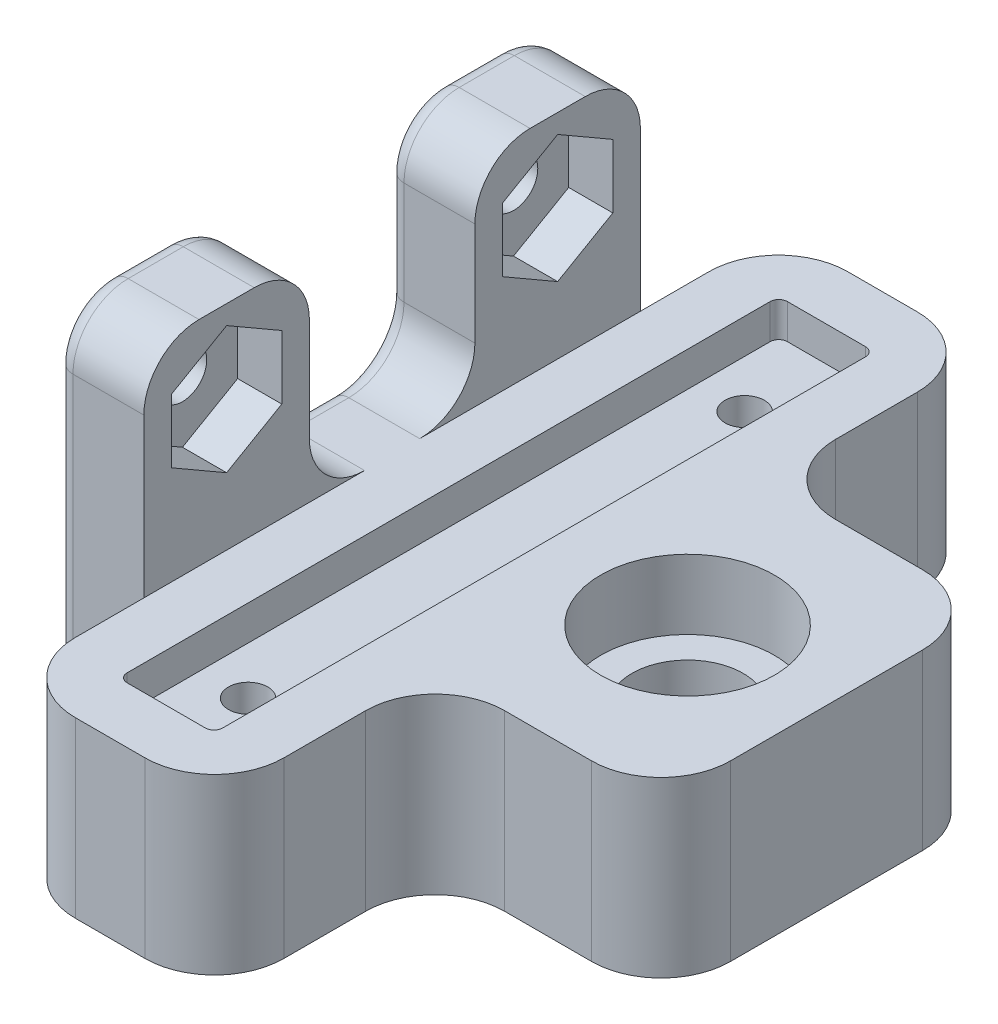
from build123d import *

# Parameters (mm, degrees)
SKETCH1_R           = 3.2
SKETCH1_R_2         = 1.1303
BOSS_EXTRUDE1_DEPTH = 10
SKETCH2_W           = 5.5
SKETCH2_H           = 38
CUT_EXTRUDE1_DEPTH  = 2
FILLET3_R           = 0.5
SKETCH5_R           = 5
CUT_EXTRUDE2_DEPTH  = 4
FILLET1_R           = 4
SKETCH4_R           = 1.397
BOSS_EXTRUDE2_DEPTH = 5.08
CUT_EXTRUDE3_DEPTH  = 2.54
FILLET5_R           = 3.175
FILLET4_R           = 1


with BuildPart() as part:
    # Sketch1 → Boss-Extrude1 (new body)
    with BuildSketch(Plane(origin=(0, 0, 0), x_dir=(1, 0, 0), z_dir=(0, 1, 0))):
        Polygon((-17, 22.225), (-5, 22.225), (-5, 9.525), (8, 9.525), (8, -9.525), (-5, -9.525), (-5, -22.225), (-17, -22.225), align=None)
        with Locations(Location((0, 0, 0), (0, 0, 270))):
            Circle(SKETCH1_R, mode=Mode.SUBTRACT)
        with Locations(Location((-11, 14.2875, 0), (0, 0, 270))):
            Circle(SKETCH1_R_2, mode=Mode.SUBTRACT)
        with Locations(Location((-11, -14.2875, 0), (0, 0, 90))):
            Circle(SKETCH1_R_2, mode=Mode.SUBTRACT)
    extrude(amount=BOSS_EXTRUDE1_DEPTH)

    # Sketch2 → Cut-Extrude1 (cut)
    with BuildSketch(Plane(origin=(0, 10, 0), x_dir=(1, 0, 0), z_dir=(0, 1, 0))):
        with Locations((-11, 0)):
            Rectangle(SKETCH2_W, SKETCH2_H)
    extrude(amount=-CUT_EXTRUDE1_DEPTH, mode=Mode.SUBTRACT)

    # Fillet3
    fillet3_edges = [part.edges().sort_by_distance(p)[0] for p in [
        (-13.75, 9, 19),
        (-13.75, 9, -19),
        (-8.25, 9, -19),
        (-8.25, 9, 19),
    ]]
    fillet(fillet3_edges, radius=FILLET3_R)

    # Sketch5 → Cut-Extrude2 (cut)
    with BuildSketch(Plane(origin=(0, 10, 0), x_dir=(1, 0, 0), z_dir=(0, 1, 0))):
        with Locations(Location((0, 0, 0), (0, 0, 270))):
            Circle(SKETCH5_R)
    extrude(amount=-CUT_EXTRUDE2_DEPTH, mode=Mode.SUBTRACT)

    # Fillet1
    fillet1_edges = [part.edges().sort_by_distance(p)[0] for p in [
        (-17, 5, 22.225),
        (-17, 5, -22.225),
        (-5, 5, -22.225),
        (-5, 5, -9.525),
        (8, 5, -9.525),
        (8, 5, 9.525),
        (-5, 5, 9.525),
        (-5, 5, 22.225),
    ]]
    fillet(fillet1_edges, radius=FILLET1_R)

    # Sketch4 → Boss-Extrude2 (add)
    with BuildSketch(Plane.ZY.offset(17)):
        Polygon((-4.7625, 10), (4.7625, 10), (4.7625, 22.2875), (14.2875, 22.2875), (14.2875, 0), (-14.2875, 0), (-14.2875, 22.2875), (-4.7625, 22.2875), align=None)
        with Locations((-9.525, 17.525)):
            Circle(SKETCH4_R, mode=Mode.SUBTRACT)
        with Locations((9.525, 17.525)):
            Circle(SKETCH4_R, mode=Mode.SUBTRACT)
    extrude(amount=BOSS_EXTRUDE2_DEPTH)

    # Sketch6 → Cut-Extrude3 (cut)
    with BuildSketch(Plane(origin=(-17, 0, 0), x_dir=(0, 0, -1), z_dir=(1, 0, 0))):
        Polygon((-6.35, 15.691912895), (-6.35, 19.358087105), (-9.525, 21.191174209), (-12.7, 19.358087105), (-12.7, 15.691912895), (-9.525, 13.858825791), align=None)
    cut_extrude3 = extrude(amount=-CUT_EXTRUDE3_DEPTH, mode=Mode.SUBTRACT)

    # Mirror1: Cut-Extrude3 across plane
    add(cut_extrude3.mirror(Plane.XY), mode=Mode.SUBTRACT)

    # Fillet5
    fillet5_edges = [part.edges().sort_by_distance(p)[0] for p in [
        (-19.54, 22.2875, 14.2875),
        (-19.54, 22.2875, 4.7625),
        (-19.54, 10, 4.7625),
        (-19.54, 10, -4.7625),
        (-19.54, 22.2875, -4.7625),
        (-19.54, 22.2875, -14.2875),
    ]]
    fillet(fillet5_edges, radius=FILLET5_R)

    # Fillet4
    fillet4_edges = [part.edges().sort_by_distance(p)[0] for p in [
        (-22.08, 9.55625, 14.2875),
        (-22.08, 10, 0),
        (-22.08, 16.14375, 4.7625),
        (-22.08, 16.14375, -4.7625),
        (-22.08, 22.2875, 9.525),
        (-22.08, 22.2875, -9.525),
        (-22.08, 9.55625, -14.2875),
        (-22.08, 21.35756403, -13.35756403),
        (-22.08, 21.35756403, -5.69243597),
        (-22.08, 21.35756403, 5.69243597),
        (-22.08, 21.35756403, 13.35756403),
        (-22.08, 10.92993597, 3.83256403),
        (-22.08, 10.92993597, -3.83256403),
    ]]
    fillet(fillet4_edges, radius=FILLET4_R)


solid = part.part
